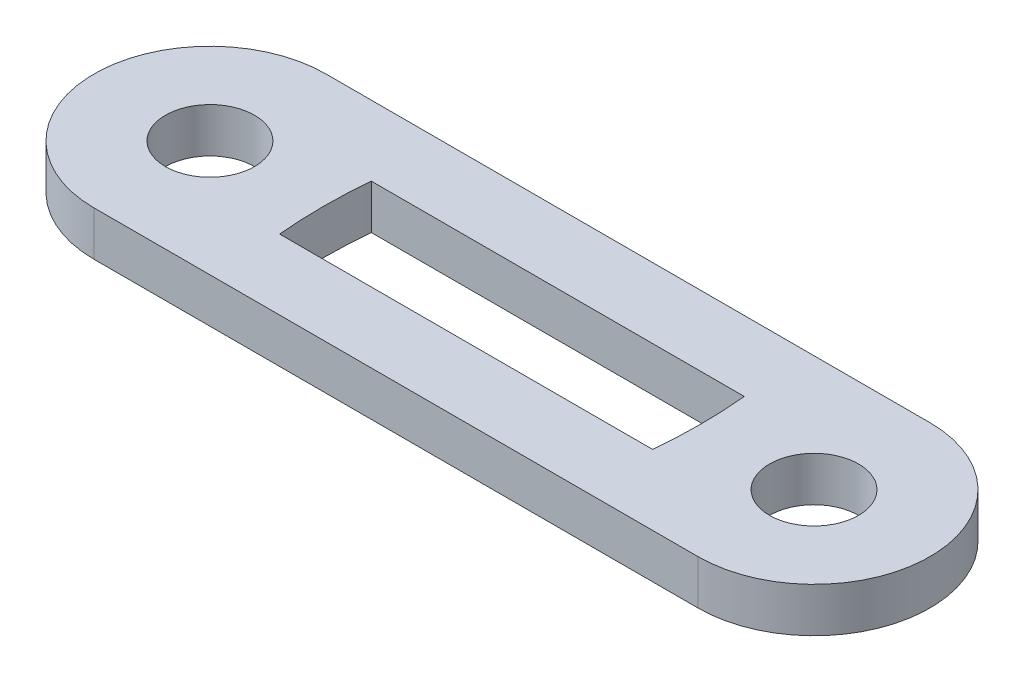
from build123d import *

# Parameters (mm, degrees)
SKETCH1_R           = 1.5875
BOSS_EXTRUDE2_DEPTH = 0.79375


with BuildPart() as part:
    # Sketch1 → Boss-Extrude2 (new, symmetric)
    with BuildSketch(Plane(origin=(0, 0, 0), x_dir=(1, 0, 0), z_dir=(0, 1, 0))):
        with BuildLine():
            Line((10.765, 4.133736316), (-10.765, 4.133736316))
            ThreePointArc((-10.765, 4.133736316), (-14.898736316, 0), (-10.765, -4.133736316))
            Line((-10.765, -4.133736316), (10.765, -4.133736316))
            ThreePointArc((10.765, -4.133736316), (14.898736316, 0), (10.765, 4.133736316))
        make_face()
        with Locations(Location((10.765, 0, 0), (0, 0, 270))):
            Circle(SKETCH1_R, mode=Mode.SUBTRACT)
        with Locations(Location((-10.765, 0, 0), (0, 0, 270))):
            Circle(SKETCH1_R, mode=Mode.SUBTRACT)
        with BuildLine():
            Line((6.647316717, -1.633736316), (-6.647316717, -1.633736316))
            ThreePointArc((-6.647316717, -1.633736316), (-6.723792634, 0), (-6.647316717, 1.633736316))
            Line((-6.647316717, 1.633736316), (6.647316717, 1.633736316))
            ThreePointArc((6.647316717, 1.633736316), (6.723792634, 0), (6.647316717, -1.633736316))
        make_face(mode=Mode.SUBTRACT)
    extrude(amount=BOSS_EXTRUDE2_DEPTH, both=True)


solid = part.part
